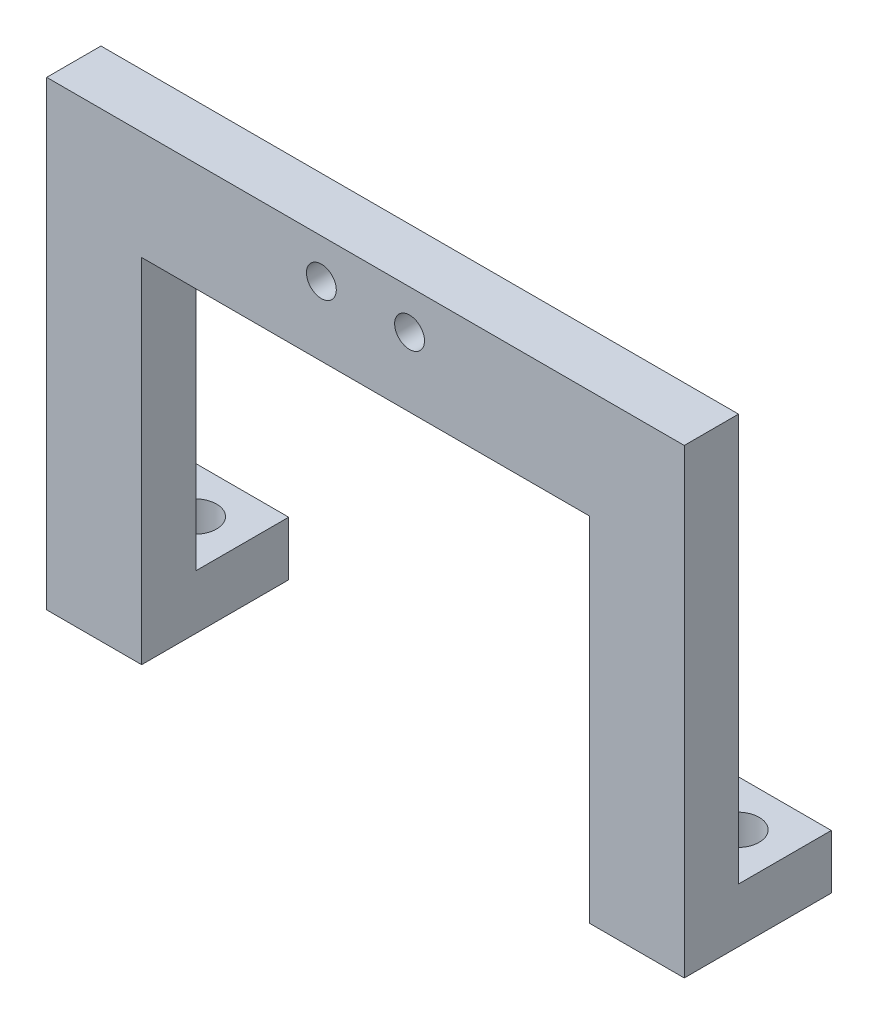
from build123d import *

# Parameters (mm, degrees)
SKETCH_2_R          = 1.6
EXTRUDE_1_DEPTH     = 4
EXTRUDE_1_2_DEPTH   = 4
SKETCH_3_W          = 7
SKETCH_3_H          = 4
EXTRUDE_2_DEPTH     = 30
SKETCH_4_W          = 47
SKETCH_4_H          = 8
EXTRUDE_3_DEPTH     = 4
SKETCH_5_R          = 1.1
CUT_EXTRUDE_1_DEPTH = 42.893116752


with BuildPart() as part:
    # 草图2 → 凸台-拉伸1 (new body)
    with BuildSketch(Plane(origin=(0, 0, 0), x_dir=(1, 0, 0), z_dir=(0, 1, 0))):
        Polygon((-23.5, 3.41991342), (-16.5, 3.41991342), (-16.5, -3.41991342), (-16.5, -7.41991342), (-23.5, -7.41991342), (-23.5, -3.41991342), align=None)
        with Locations(Location((-20, 0, 0), (0, 0, 270))):
            Circle(SKETCH_2_R, mode=Mode.SUBTRACT)
    extrude(amount=EXTRUDE_1_DEPTH)



with BuildPart() as body_2:
    # 草图2 → Extrude 1 2 (new body)
    with BuildSketch(Plane(origin=(0, 0, 0), x_dir=(1, 0, 0), z_dir=(0, 1, 0))):
        Polygon((23.5, -7.41991342), (23.5, -3.41991342), (23.5, 3.41991342), (16.5, 3.41991342), (16.5, -3.41991342), (16.5, -7.41991342), align=None)
        with Locations(Location((20, 0, 0), (0, 0, 90))):
            Circle(SKETCH_2_R, mode=Mode.SUBTRACT)
    extrude(amount=EXTRUDE_1_2_DEPTH)


with BuildPart() as part_1:
    add(part.part)

    add(body_2.part)  # 凸台-拉伸2 merges body 2
    # 草图3 → 凸台-拉伸2 (add)
    with BuildSketch(Plane(origin=(0, 4, 0), x_dir=(1, 0, 0), z_dir=(0, 1, 0))):
        with Locations((-20, -5.41991342)):
            Rectangle(SKETCH_3_W, SKETCH_3_H)
        with Locations((20, -5.41991342)):
            Rectangle(SKETCH_3_W, SKETCH_3_H)
    extrude(amount=EXTRUDE_2_DEPTH)

    # 草图4 → 凸台-拉伸3 (add)
    with BuildSketch(Plane(origin=(0, 0, 3.41991342), x_dir=(-1, 0, 0), z_dir=(0, 0, -1))):
        with Locations((0, 30)):
            Rectangle(SKETCH_4_W, SKETCH_4_H)
    extrude(amount=-EXTRUDE_3_DEPTH)

    # 草图5 → 切除-拉伸1 (cut, through all)
    with BuildSketch(Plane(origin=(0, 0, 3.41991342), x_dir=(-1, 0, 0), z_dir=(0, 0, -1))):
        with Locations((-3.25, 31.1)):
            Circle(SKETCH_5_R)
        with Locations(Location((3.25, 31.1, 0), (0, 0, 180))):
            Circle(SKETCH_5_R)
    extrude(amount=-CUT_EXTRUDE_1_DEPTH, mode=Mode.SUBTRACT)


solid = part_1.part
